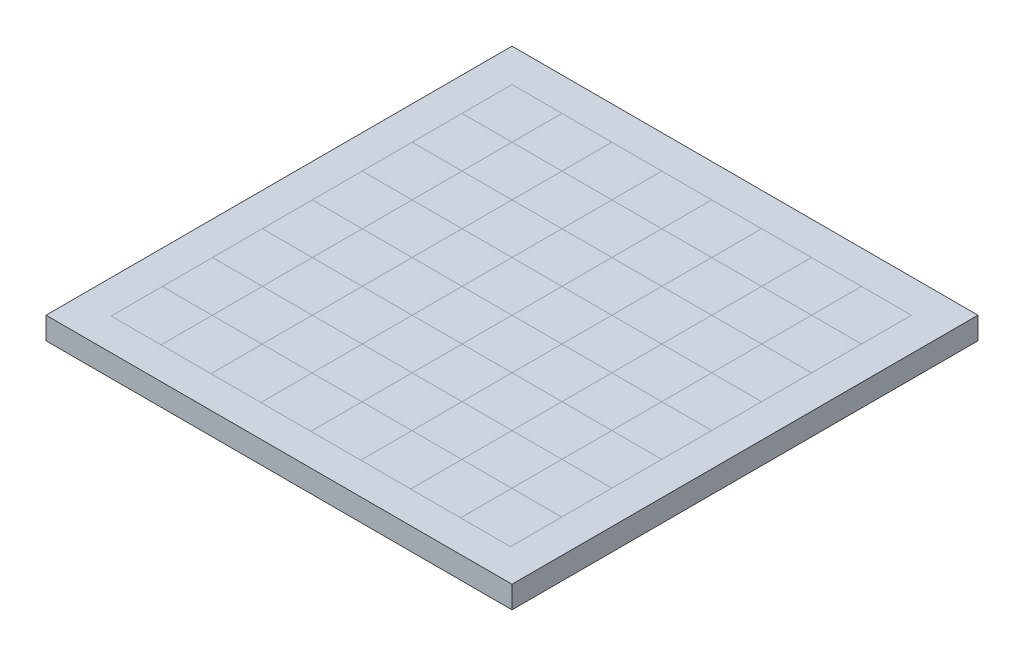
from build123d import *

# Parameters (mm, degrees)
SKETCH1_W           = 533.4
SKETCH1_H           = 533.4
BOSS_EXTRUDE1_DEPTH = 25.4


with BuildPart() as part:
    # Sketch1 → Boss-Extrude1 (new body)
    with BuildSketch(Plane(origin=(0, 0, 0), x_dir=(1, 0, 0), z_dir=(0, 1, 0))):
        with Locations((266.7, 266.7)):
            Rectangle(SKETCH1_W, SKETCH1_H)
    extrude(amount=BOSS_EXTRUDE1_DEPTH)


solid = part.part
